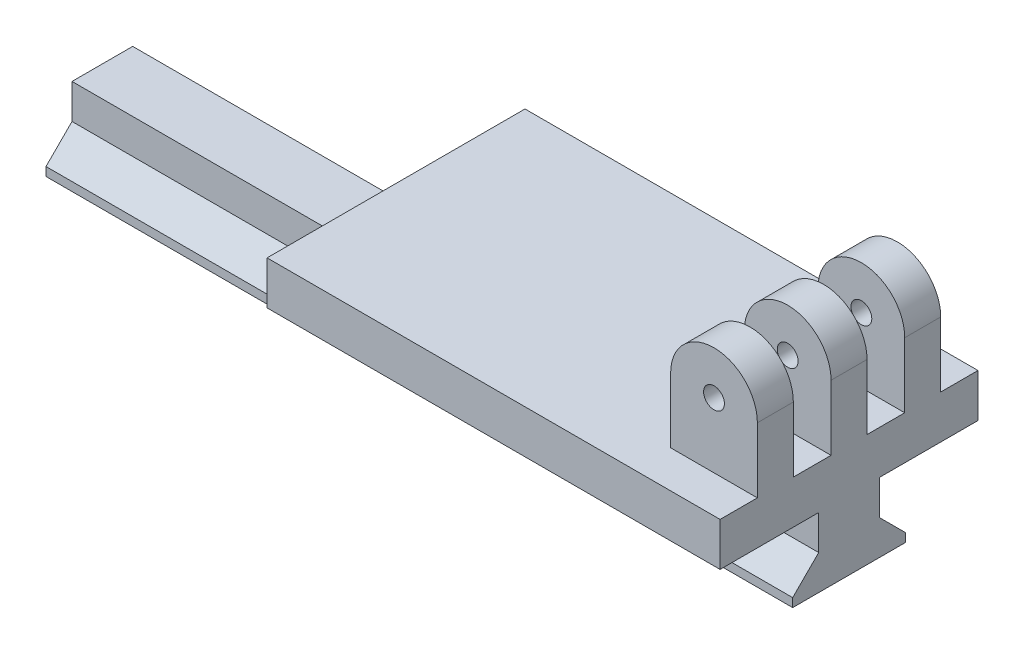
from build123d import *

# Parameters (mm, degrees)
SKETCH1_W                       = 104.5
SKETCH1_H                       = 59.5
BOSS_EXTRUDE1_DEPTH             = 10
BOSS_EXTRUDE2_REACH             = 62.952
BOSS_EXTRUDE2_DIRECTION_2_REACH = 62.952
SKETCH4_W                       = 20
SKETCH4_H                       = 8.6
SKETCH4_H_2                     = 8.7
CUT_EXTRUDE1_DEPTH              = 66.116242213
M4_CLEARANCE_HOLE1_D            = 4.8
BOSS_EXTRUDE3_REACH             = 71.571
BOSS_EXTRUDE3_DIRECTION_2_DEPTH = 120


with BuildPart() as part:
    # Sketch1 → Boss-Extrude1 (new body)
    with BuildSketch(Plane(origin=(0, 0, 0), x_dir=(1, 0, 0), z_dir=(0, 1, 0))):
        Rectangle(SKETCH1_W, SKETCH1_H)
    extrude(amount=BOSS_EXTRUDE1_DEPTH)

    # Boss-Extrude2: up to this face of the body (flat: up to its plane)
    boss_extrude2_end = Plane(part.part.faces().sort_by_distance((0, 5, 29.75))[0])
    # Sketch3 → Boss-Extrude2 (add, up to the picked face)
    with BuildSketch(Plane.XY, mode=Mode.PRIVATE) as boss_extrude2_sk1:
        with BuildLine():
            Line((52.25, 10), (52.25, 25))
            ThreePointArc((52.25, 25), (42.25, 35), (32.25, 25))
            Line((32.25, 25), (32.25, 10))
            Line((32.25, 10), (52.25, 10))
        make_face()
    boss_extrude2_tool1 = split(extrude(boss_extrude2_sk1.sketch, amount=BOSS_EXTRUDE2_REACH, mode=Mode.PRIVATE), bisect_by=boss_extrude2_end, keep=Keep.BOTH, mode=Mode.PRIVATE)
    add(boss_extrude2_tool1.solids().sort_by(Axis((42.25, 21.535979, 0), (0, 0, 1)))[0])

    # Boss-Extrude2 direction 2: up to this face of the body (flat: up to its plane)
    boss_extrude2_direction_2_end = Plane(part.part.faces().sort_by_distance((0, 5, -29.75))[0])
    # Sketch3 → Boss-Extrude2 direction 2 (add, up to the picked face)
    with BuildSketch(Plane.XY, mode=Mode.PRIVATE) as boss_extrude2_direction_2_sk1:
        with BuildLine():
            Line((52.25, 10), (52.25, 25))
            ThreePointArc((52.25, 25), (42.25, 35), (32.25, 25))
            Line((32.25, 25), (32.25, 10))
            Line((32.25, 10), (52.25, 10))
        make_face()
    boss_extrude2_direction_2_tool1 = split(extrude(boss_extrude2_direction_2_sk1.sketch, amount=-BOSS_EXTRUDE2_DIRECTION_2_REACH, mode=Mode.PRIVATE), bisect_by=boss_extrude2_direction_2_end, keep=Keep.BOTH, mode=Mode.PRIVATE)
    add(boss_extrude2_direction_2_tool1.solids().sort_by(Axis((42.25, 21.535979, 0), (0, 0, -1)))[0])

    # Sketch4 → Cut-Extrude1 (cut, through all)
    with BuildSketch(Plane(origin=(0, 10, 0), x_dir=(1, 0, 0), z_dir=(0, 1, 0))):
        with Locations((42.25, 25.45)):
            Rectangle(SKETCH4_W, SKETCH4_H)
        with Locations((42.25, 8.5)):
            Rectangle(SKETCH4_W, SKETCH4_H_2)
        with Locations((42.25, -8.5)):
            Rectangle(SKETCH4_W, SKETCH4_H_2)
        with Locations((42.25, -25.45)):
            Rectangle(SKETCH4_W, SKETCH4_H)
    extrude(amount=CUT_EXTRUDE1_DEPTH, mode=Mode.SUBTRACT)

    # M4 Clearance Hole1 (through all)
    with Locations(Plane.XY.offset(29.75)):
        with Locations((42.25, 25)):
            Hole(M4_CLEARANCE_HOLE1_D / 2)

    # Boss-Extrude3: up to this face of the body (flat: up to its plane)
    boss_extrude3_end = Plane(part.part.faces().sort_by_distance((52.25, 9.820598864, 0))[0])
    # Sketch8 → Boss-Extrude3 (add, up to the picked face)
    with BuildSketch(Plane(origin=(0, 0, 0), x_dir=(0, 0, -1), z_dir=(1, 0, 0)), mode=Mode.PRIVATE) as boss_extrude3_sk1:
        Polygon((-7, 0), (-7, -8), (-13, -14), (-13, -16), (13, -16), (13, -14), (7, -8), (7, 0), align=None)
    boss_extrude3_tool1 = split(extrude(boss_extrude3_sk1.sketch, amount=BOSS_EXTRUDE3_REACH, mode=Mode.PRIVATE), bisect_by=boss_extrude3_end, keep=Keep.BOTH, mode=Mode.PRIVATE)
    add(boss_extrude3_tool1.solids().sort_by(Axis((0, -9.098592, 0), (1, 0, 0)))[0])

    # Sketch8 → Boss-Extrude3 direction 2 (add)
    with BuildSketch(Plane(origin=(0, 0, 0), x_dir=(0, 0, -1), z_dir=(1, 0, 0))):
        Polygon((-7, 0), (-7, -8), (-13, -14), (-13, -16), (13, -16), (13, -14), (7, -8), (7, 0), align=None)
    extrude(amount=-BOSS_EXTRUDE3_DIRECTION_2_DEPTH)


solid = part.part
